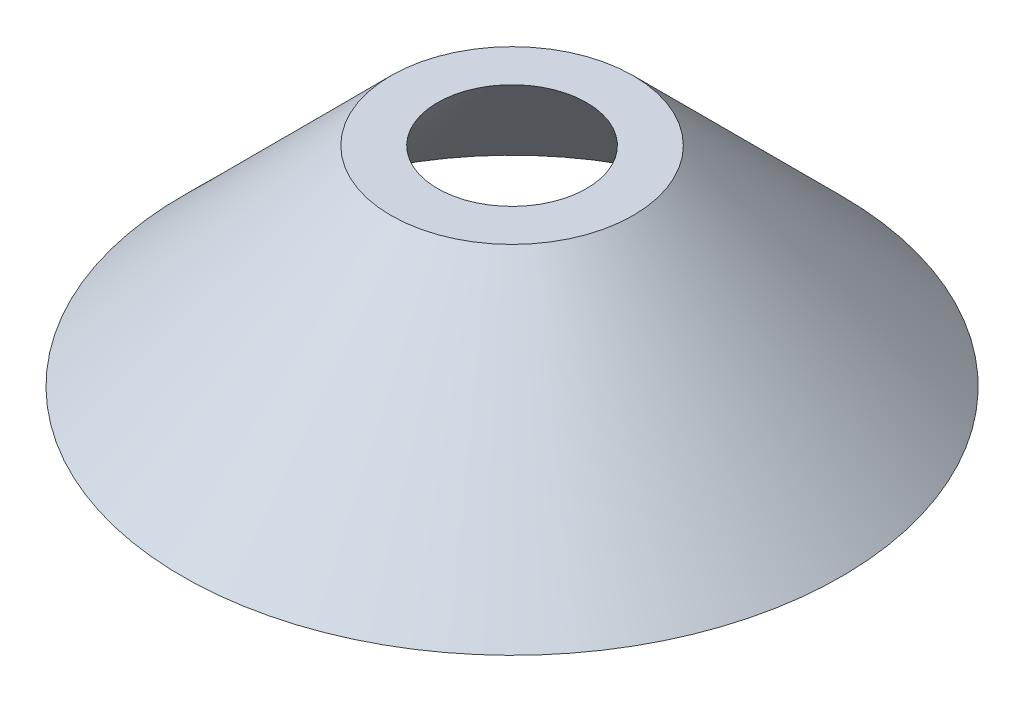
from build123d import *


with BuildPart() as part:
    # Sketch1 → Revolve1 (revolve)
    with BuildSketch(Plane.XY, mode=Mode.PRIVATE) as revolve1_sk:
        Polygon((-22.262023933, 38.314492225), (-60.576516158, 0), (-52.012699396, 0), (-13.698207171, 38.314492225), align=None)
    revolve(revolve1_sk.sketch.rotate(Axis((0, 0, 0), (0, 1, 0)), 270), axis=Axis((0, 0, 0), (0, 1, 0)))


solid = part.part
